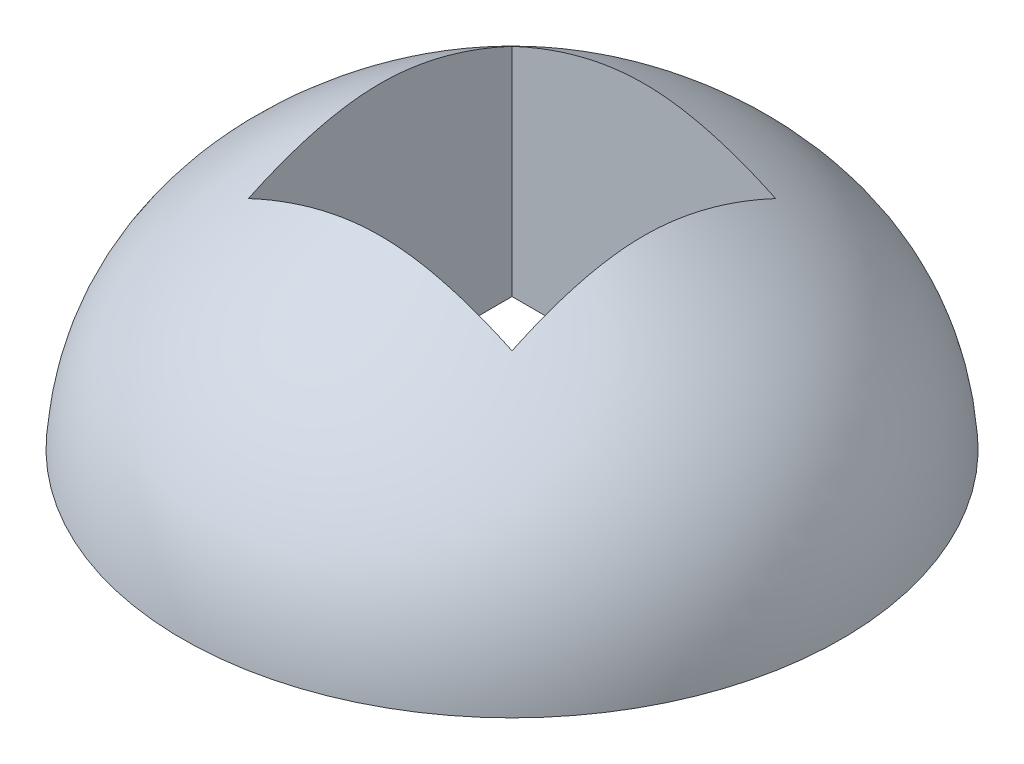
from build123d import *

# Parameters (mm, degrees)
SKETCH2_W          = 0.4
SKETCH2_H          = 0.4
CUT_EXTRUDE1_DEPTH = 1.866025577


with BuildPart() as part:
    # Sketch1 → Revolve1 (revolve)
    with BuildSketch(Plane.XY):
        with BuildLine():
            Line((0, 0), (0, 0.5))
            add(Edge.make_bspline(
                [(0.5, 0), (0.480286731, 0.285294789), (0.196047082, 0.362615465), (0, 0.5)],
                knots=[0, 0, 0, 0, 1, 1, 1, 1], degree=3))
            Line((0.5, 0), (0, 0))
        make_face()
    revolve(axis=Axis((0, 0, 0), (0, 1, 0)))

    # Sketch2 → Cut-Extrude1 (cut, through all)
    with BuildSketch(Plane.XZ):
        Rectangle(SKETCH2_W, SKETCH2_H)
    extrude(amount=-CUT_EXTRUDE1_DEPTH, mode=Mode.SUBTRACT)


solid = part.part
